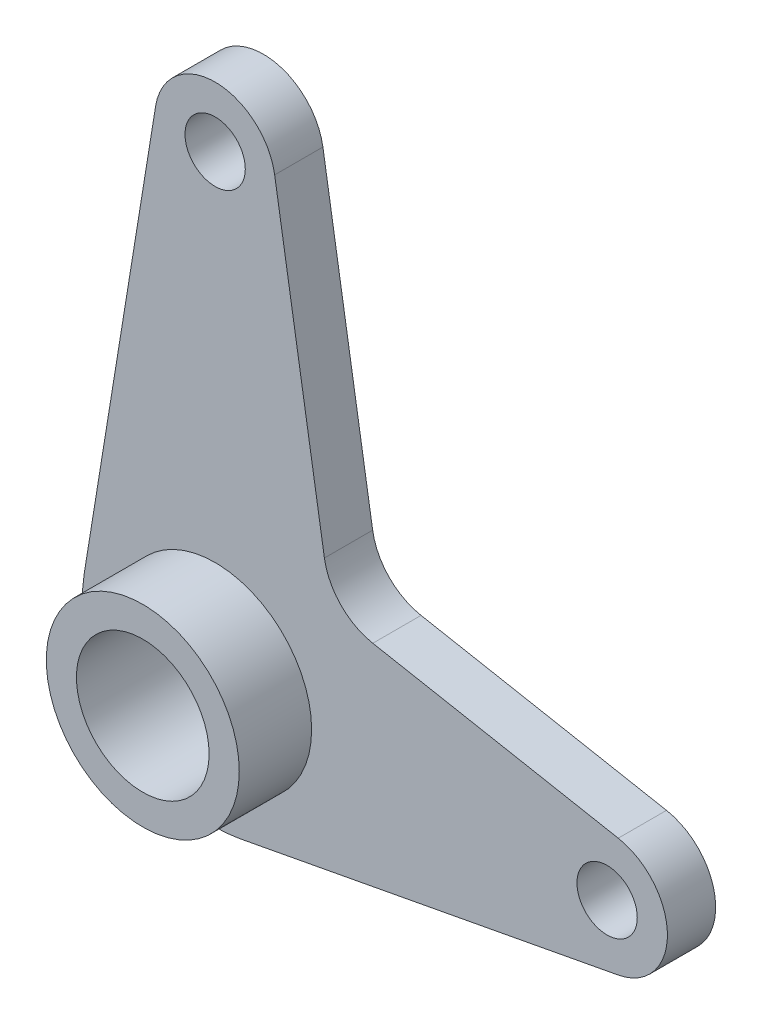
from build123d import *

# Parameters (mm, degrees)
SKETCH1_R           = 5
BOSS_EXTRUDE1_DEPTH = 8
SKETCH4_R           = 16
BOSS_EXTRUDE3_DEPTH = 12
SKETCH5_R           = 11
CUT_EXTRUDE3_DEPTH  = 116.108644332


with BuildPart() as part:
    # Sketch1 → Boss-Extrude1 (new body)
    with BuildSketch(Plane.XY):
        with BuildLine():
            Line((-9.871170143, 76.6), (-21.716574315, 3.52))
            ThreePointArc((-21.716574315, 3.52), (-15.360764468, -15.749505229), (4.061538462, -21.62183862))
            Line((4.061538462, -21.62183862), (66.846153846, -9.828108464))
            ThreePointArc((66.846153846, -9.828108464), (74.999999999, -0.000112634), (66.846375241, 9.828066874))
            Line((66.846375241, 9.828066874), (26.145857586, 17.474375048))
            ThreePointArc((26.145857586, 17.474375048), (20.833288171, 20.320356887), (18.121062683, 25.702441922))
            Line((18.121062683, 25.702441922), (9.871170143, 76.6))
            ThreePointArc((9.871170143, 76.6), (0, 85), (-9.871170143, 76.6))
        make_face()
        with Locations((0, 75)):
            Circle(SKETCH1_R, mode=Mode.SUBTRACT)
        with Locations((65, 0)):
            Circle(SKETCH1_R, mode=Mode.SUBTRACT)
    extrude(amount=BOSS_EXTRUDE1_DEPTH)

    # Sketch4 → Boss-Extrude3 (add)
    with BuildSketch(Plane.XY.offset(8)):
        Circle(SKETCH4_R)
    extrude(amount=BOSS_EXTRUDE3_DEPTH)

    # Sketch5 → Cut-Extrude3 (cut, through all)
    with BuildSketch(Plane.XY.offset(20)):
        Circle(SKETCH5_R)
    extrude(amount=-CUT_EXTRUDE3_DEPTH, mode=Mode.SUBTRACT)


solid = part.part
